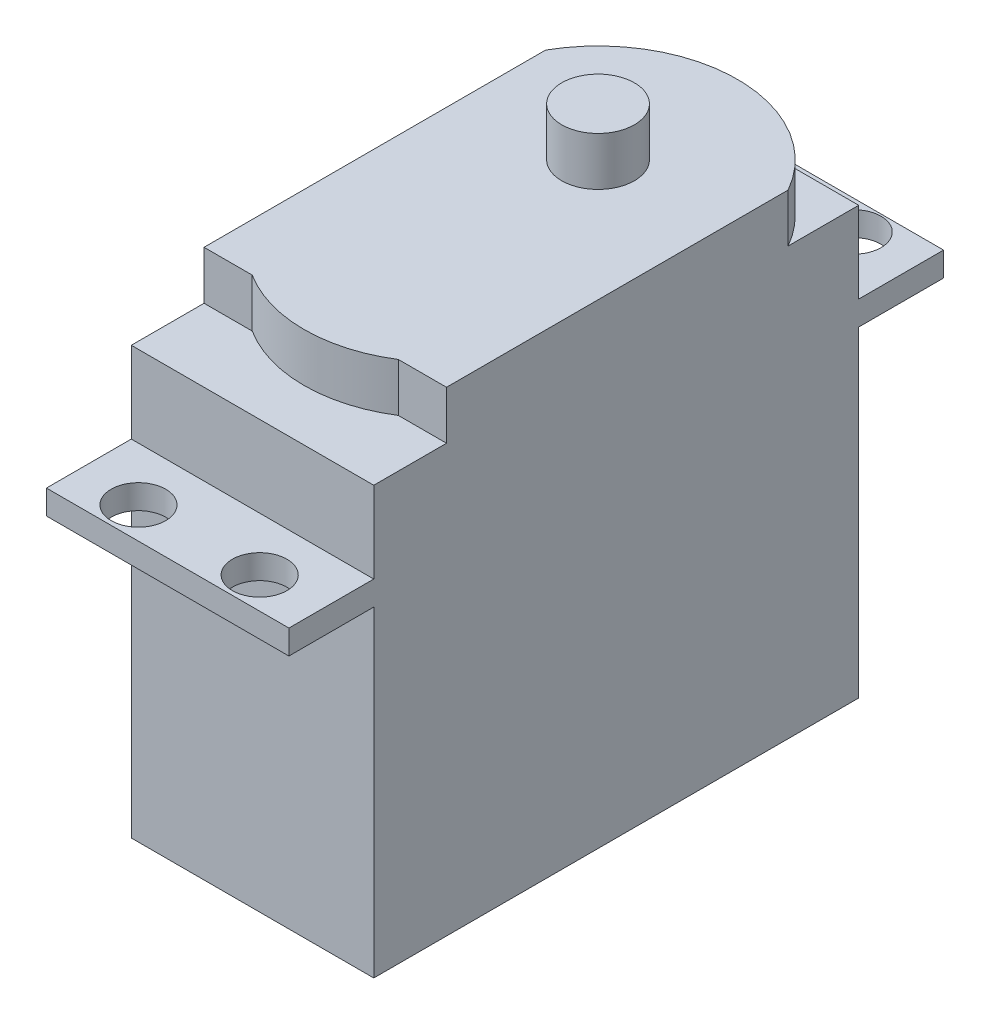
from build123d import *

# Parameters (mm, degrees)
BOSS_EXTRUDE1_DEPTH = 20
SKETCH2_W           = 20
SKETCH2_H           = 40
CUT_EXTRUDE1_DEPTH  = 2.5
SKETCH3_W           = 20
SKETCH3_H           = 40
SKETCH3_R           = 3
CUT_EXTRUDE2_DEPTH  = 4
CUT_EXTRUDE3_DEPTH  = 4
SKETCH5_R           = 2.25
CUT_EXTRUDE4_DEPTH  = 2
CHAMFER1_SIZE       = 1.5


with BuildPart() as part:
    # Sketch1 → Boss-Extrude1 (new body)
    with BuildSketch(Plane(origin=(0, 0, 0), x_dir=(0, 0, -1), z_dir=(1, 0, 0))):
        Polygon((0, -23.6), (20, -23.6), (20, 4.4), (27, 4.4), (27, 6.4), (20, 6.4), (20, 12.4), (20, 23.6), (-20, 23.6), (-20, 12.4), (-20, 6.4), (-27, 6.4), (-27, 4.4), (-20, 4.4), (-20, -23.6), align=None)
    extrude(amount=BOSS_EXTRUDE1_DEPTH)

    # Sketch2 → Cut-Extrude1 (cut)
    with BuildSketch(Plane(origin=(0, 23.6, 0), x_dir=(1, 0, 0), z_dir=(0, 1, 0))):
        with Locations((10, 0)):
            Rectangle(SKETCH2_W, SKETCH2_H)
    extrude(amount=-CUT_EXTRUDE1_DEPTH, mode=Mode.SUBTRACT)

    # Sketch3 → Cut-Extrude2 (cut)
    with BuildSketch(Plane(origin=(0, 21.1, 0), x_dir=(1, 0, 0), z_dir=(0, 1, 0))):
        with Locations((10, 0)):
            Rectangle(SKETCH3_W, SKETCH3_H)
        with Locations(Location((10, 8.5, 0), (0, 0, 270))):
            Circle(SKETCH3_R, mode=Mode.SUBTRACT)
    extrude(amount=-CUT_EXTRUDE2_DEPTH, mode=Mode.SUBTRACT)

    # Sketch4 → Cut-Extrude3 (cut)
    with BuildSketch(Plane(origin=(0, 17.1, 0), x_dir=(1, 0, 0), z_dir=(0, 1, 0))):
        with BuildLine():
            Line((10.000000061, 20), (0, 20))
            Line((0, 20), (0, 14.178908346))
            ThreePointArc((0, 14.178908346), (4.214563395, 18.438748578), (10.000000061, 20))
        make_face()
        with BuildLine():
            Line((20, 20), (10.000000061, 20))
            ThreePointArc((10.000000061, 20), (15.785436657, 18.438748547), (20, 14.178908346))
            Line((20, 14.178908346), (20, 20))
        make_face()
        with BuildLine():
            Line((3.974014603, -14), (0, -14))
            Line((0, -14), (0, -20))
            Line((0, -20), (20, -20))
            Line((20, -20), (20, -14))
            Line((20, -14), (16.025985397, -14))
            ThreePointArc((16.025985397, -14), (10, -15.75), (3.974014603, -14))
        make_face()
    extrude(amount=-CUT_EXTRUDE3_DEPTH, mode=Mode.SUBTRACT)

    # Sketch5 → Cut-Extrude4 (cut)
    with BuildSketch(Plane(origin=(0, 6.4, 0), x_dir=(1, 0, 0), z_dir=(0, 1, 0))):
        with Locations(Location((5, -24.410545827, 0), (0, 0, 270))):
            Circle(SKETCH5_R)
        with Locations(Location((15, -24.410545827, 0), (0, 0, 270))):
            Circle(SKETCH5_R)
        with Locations(Location((15, 24.589454173, 0), (0, 0, 90))):
            Circle(SKETCH5_R)
        with Locations(Location((5, 24.589454173, 0), (0, 0, 90))):
            Circle(SKETCH5_R)
    extrude(amount=-CUT_EXTRUDE4_DEPTH, mode=Mode.SUBTRACT)

    # Chamfer1
    chamfer1_edges = [part.edges().sort_by_distance(p)[0] for p in [
        (0, -23.6, 0),
        (10, -23.6, 20),
        (10, -23.6, -20),
        (20, -23.6, 0),
    ]]
    chamfer(chamfer1_edges, length=CHAMFER1_SIZE)


solid = part.part
